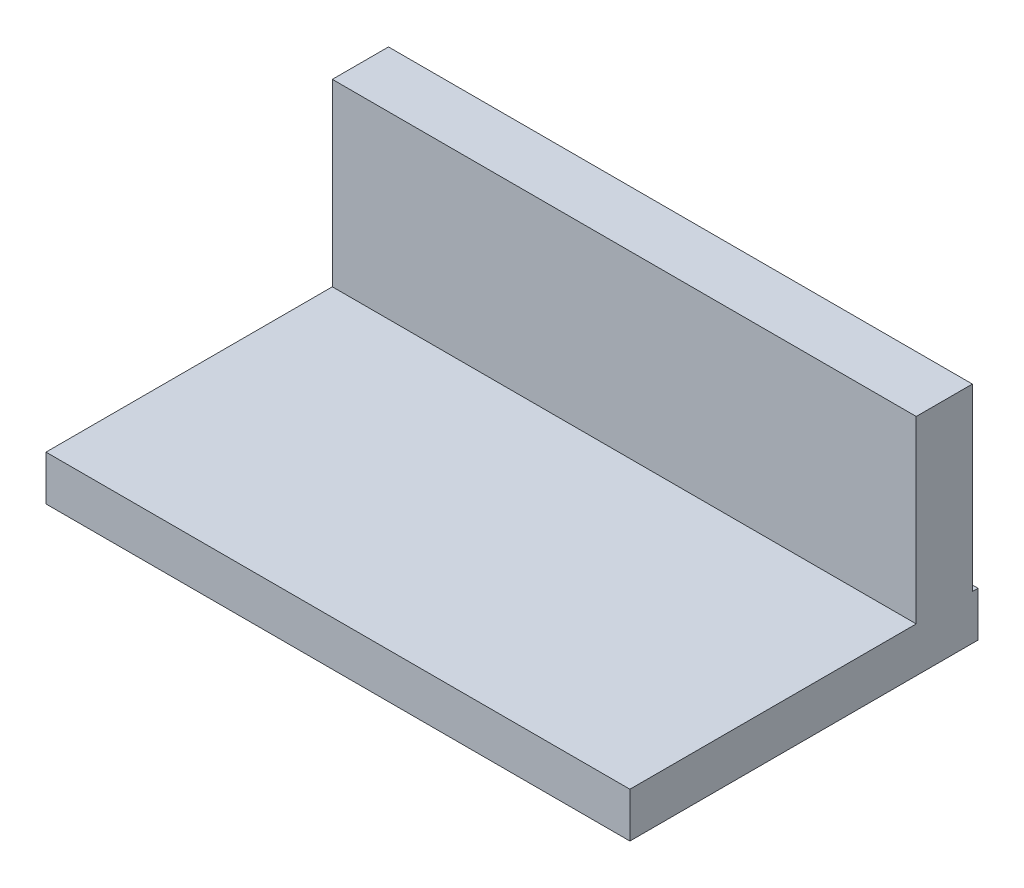
from build123d import *

# Parameters (mm, degrees)
SKETCH1_W           = 26
SKETCH1_H           = 15.5
BOSS_EXTRUDE1_DEPTH = 2
SKETCH3_W           = 26
SKETCH3_H           = 2.5
BOSS_EXTRUDE2_DEPTH = 8


with BuildPart() as part:
    # Sketch1 → Boss-Extrude1 (new body)
    with BuildSketch(Plane(origin=(0, 0, 0), x_dir=(1, 0, 0), z_dir=(0, 1, 0))):
        Rectangle(SKETCH1_W, SKETCH1_H)
    extrude(amount=BOSS_EXTRUDE1_DEPTH)

    # Sketch3 → Boss-Extrude2 (add)
    with BuildSketch(Plane(origin=(0, 2, 0), x_dir=(1, 0, 0), z_dir=(0, 1, 0))):
        with Locations((0, 6.25)):
            Rectangle(SKETCH3_W, SKETCH3_H)
    extrude(amount=BOSS_EXTRUDE2_DEPTH)


solid = part.part
